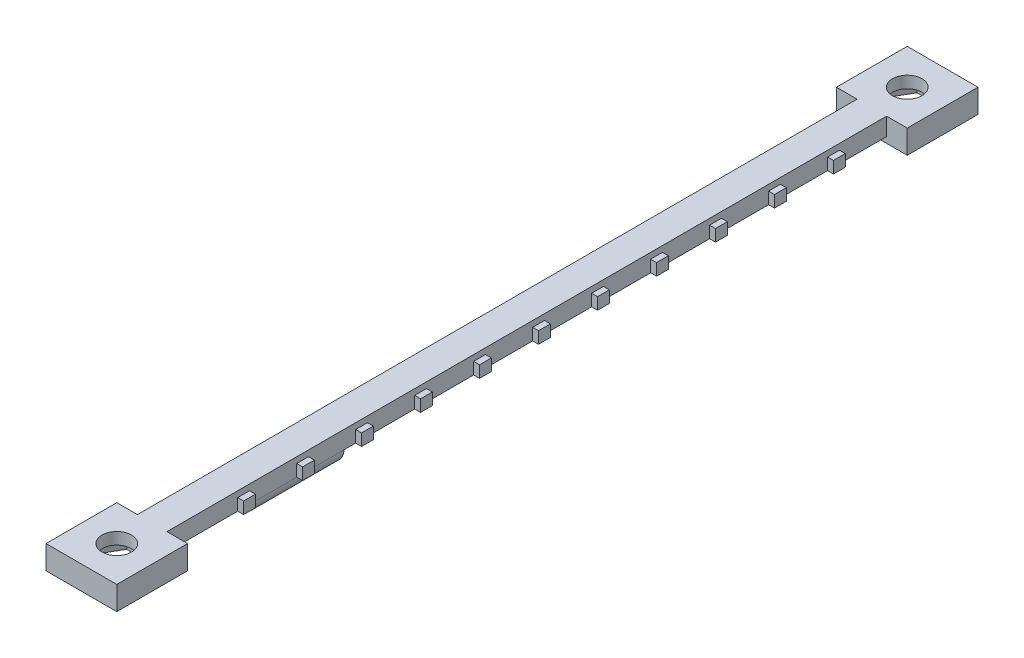
from build123d import *

# Parameters (mm, degrees)
BOSS_EXTRUDE1_DEPTH = 2
BOSS_EXTRUDE2_DEPTH = 1
SKETCH3_W           = 12
SKETCH3_H           = 12
BOSS_EXTRUDE3_DEPTH = 1
CUT_EXTRUDE1_DEPTH  = 2
SKETCH5_R           = 2.5
CUT_EXTRUDE2_DEPTH  = 5
SKETCH6_W           = 3
SKETCH6_H           = 15
BOSS_EXTRUDE4_DEPTH = 5
CUT_EXTRUDE3_DEPTH  = 30
SKETCH9_W           = 3
SKETCH9_H           = 7
CUT_EXTRUDE5_DEPTH  = 20
SKETCH10_W          = 5
SKETCH10_H          = 15
BOSS_EXTRUDE5_DEPTH = 3
CUT_EXTRUDE7_DEPTH  = 20


with BuildPart() as part:
    # Sketch1 → Boss-Extrude1 (new body)
    with BuildSketch(Plane(origin=(0, 0, 0), x_dir=(1, 0, 0), z_dir=(0, 1, 0))):
        Polygon((7.22672382, 6.096), (7.22672382, 18.096), (6.22672382, 18.096), (6.22672382, 20.096), (7.22672382, 20.096), (7.22672382, 28.096), (6.22672382, 28.096), (6.22672382, 30.096), (7.22672382, 30.096), (7.22672382, 38.096), (6.22672382, 38.096), (6.22672382, 40.096), (7.22672382, 40.096), (7.22672382, 48.096), (6.22672382, 48.096), (6.22672382, 50.096), (7.22672382, 50.096), (7.22672382, 58.096), (6.22672382, 58.096), (6.22672382, 60.096), (7.22672382, 60.096), (7.22672382, 68.096), (6.22672382, 68.096), (6.22672382, 70.096), (7.22672382, 70.096), (7.22672382, 78.096), (6.22672382, 78.096), (6.22672382, 80.096), (7.22672382, 80.096), (7.22672382, 88.096), (6.22672382, 88.096), (6.22672382, 90.096), (7.22672382, 90.096), (7.22672382, 98.096), (6.22672382, 98.096), (6.22672382, 100.096), (7.22672382, 100.096), (7.22672382, 108.096), (6.22672382, 108.096), (6.22672382, 110.096), (7.22672382, 110.096), (7.22672382, 118.096), (6.22672382, 118.096), (6.22672382, 120.096), (7.22672382, 120.096), (7.22672382, 128.096), (3.72672382, 128.096), (3.72672382, 140.096), (15.72672382, 140.096), (15.72672382, 128.096), (12.22672382, 128.096), (12.22672382, 120.096), (13.22672382, 120.096), (13.22672382, 118.096), (12.22672382, 118.096), (12.22672382, 110.096), (13.226723821, 110.096), (13.226723821, 108.096), (12.22672382, 108.096), (12.22672382, 100.096), (13.226723821, 100.096), (13.226723821, 98.096), (12.22672382, 98.096), (12.22672382, 90.096), (13.226723821, 90.096), (13.226723821, 88.096), (12.22672382, 88.096), (12.22672382, 80.096), (13.226723821, 80.096), (13.226723821, 78.096), (12.22672382, 78.096), (12.22672382, 70.096), (13.226723821, 70.096), (13.226723821, 68.096), (12.22672382, 68.096), (12.22672382, 60.096), (13.226723821, 60.096), (13.226723821, 58.096), (12.22672382, 58.096), (12.22672382, 50.096), (13.226723821, 50.096), (13.226723821, 48.096), (12.22672382, 48.096), (12.22672382, 40.096), (13.226723821, 40.096), (13.226723821, 38.096), (12.22672382, 38.096), (12.22672382, 30.096), (13.226723821, 30.096), (13.226723821, 28.096), (12.22672382, 28.096), (12.22672382, 20.096), (13.226723821, 20.096), (13.226723821, 18.096), (12.22672382, 18.096), (12.22672382, 6.096), (15.72672382, 6.096), (15.72672382, -5.904), (3.72672382, -5.904), (3.72672382, 6.096), align=None)
    extrude(amount=BOSS_EXTRUDE1_DEPTH)

    # Sketch2 → Boss-Extrude2 (add)
    with BuildSketch(Plane(origin=(0, 2, 0), x_dir=(1, 0, 0), z_dir=(0, 1, 0))):
        Polygon((3.72672382, 140.096), (15.72672382, 140.096), (15.72672382, 128.096), (12.22672382, 128.096), (12.22672382, 6.096), (15.72672382, 6.096), (15.72672382, -5.904), (3.72672382, -5.904), (3.72672382, 6.096), (7.22672382, 6.096), (7.22672382, 128.096), (3.72672382, 128.096), align=None)
    extrude(amount=BOSS_EXTRUDE2_DEPTH)

    # Sketch3 → Boss-Extrude3 (add)
    with BuildSketch(Plane(origin=(0, 0, 0), x_dir=(-1, 0, 0), z_dir=(0, -1, 0))):
        with Locations((-9.72672382, 134.096)):
            Rectangle(SKETCH3_W, SKETCH3_H)
        with Locations((-9.72672382, 0.096)):
            Rectangle(SKETCH3_W, SKETCH3_H)
    extrude(amount=BOSS_EXTRUDE3_DEPTH)

    # Sketch4 → Cut-Extrude1 (cut)
    with BuildSketch(Plane(origin=(0, -1, 0), x_dir=(-1, 0, 0), z_dir=(0, -1, 0))):
        Polygon((-7.365059478, 138.096), (-11.983861632, 138.096), (-14.293262708, 134.096), (-11.983861632, 130.096), (-7.365059478, 130.096), (-5.055658401, 134.096), align=None)
        Polygon((-7.417322744, 4.096), (-12.036124897, 4.096), (-14.345525974, 0.096), (-12.036124897, -3.904), (-7.417322744, -3.904), (-5.107921667, 0.096), align=None)
    extrude(amount=-CUT_EXTRUDE1_DEPTH, mode=Mode.SUBTRACT)

    # Sketch5 → Cut-Extrude2 (cut)
    with BuildSketch(Plane(origin=(0, 1, 0), x_dir=(-1, 0, 0), z_dir=(0, -1, 0))):
        with Locations(Location((-9.72672382, 0.096, 0), (0, 0, 90))):
            Circle(SKETCH5_R)
        with Locations(Location((-9.72672382, 134.096, 0), (0, 0, 90))):
            Circle(SKETCH5_R)
    extrude(amount=-CUT_EXTRUDE2_DEPTH, mode=Mode.SUBTRACT)

    # Sketch6 → Boss-Extrude4 (add)
    with BuildSketch(Plane(origin=(0, 0, 0), x_dir=(-1, 0, 0), z_dir=(0, -1, 0))):
        with Locations((-9.72672382, 28.596)):
            Rectangle(SKETCH6_W, SKETCH6_H)
    extrude(amount=BOSS_EXTRUDE4_DEPTH)

    # Sketch7 → Cut-Extrude3 (cut)
    with BuildSketch(Plane(origin=(0, 0, -36.096), x_dir=(-1, 0, 0), z_dir=(0, 0, -1))):
        with BuildLine():
            Line((-9.72672381, -5), (-8.22672382, -5))
            Line((-8.22672382, -5), (-8.22672382, -1))
            add(Edge.make_bspline(
                [(-9.72672382, -5), (-8.22672382, -5), (-8.22672382, -1)],
                knots=[6.283185307, 6.283185307, 6.283185307, 7.853981634, 7.853981634, 7.853981634], degree=2, weights=[1, 0.707106781, 1]))
        make_face()
        with BuildLine():
            Line((-11.22672382, -5), (-9.72672381, -5))
            add(Edge.make_bspline(
                [(-11.22672382, -1), (-11.22672382, -5), (-9.72672382, -5)],
                knots=[4.71238898, 4.71238898, 4.71238898, 6.283185307, 6.283185307, 6.283185307], degree=2, weights=[1, 0.707106781, 1]))
            Line((-11.22672382, -1), (-11.22672382, -5))
        make_face()
    extrude(amount=-CUT_EXTRUDE3_DEPTH, mode=Mode.SUBTRACT)

    # Sketch9 → Cut-Extrude5 (cut)
    with BuildSketch(Plane.XY.offset(-21.096)):
        with Locations((9.72672382, -3.5)):
            Rectangle(SKETCH9_W, SKETCH9_H)
    extrude(amount=-CUT_EXTRUDE5_DEPTH, mode=Mode.SUBTRACT)

    # Sketch10 → Boss-Extrude5 (add)
    with BuildSketch(Plane(origin=(0, 0, 0), x_dir=(-1, 0, 0), z_dir=(0, -1, 0))):
        with Locations((-9.72672382, 28.596)):
            Rectangle(SKETCH10_W, SKETCH10_H)
    extrude(amount=BOSS_EXTRUDE5_DEPTH)

    # Sketch11 → Cut-Extrude7 (cut)
    with BuildSketch(Plane(origin=(0, 0, -36.096), x_dir=(-1, 0, 0), z_dir=(0, 0, -1))):
        with BuildLine():
            Line((-7.22672382, -3), (-7.22672382, 0))
            ThreePointArc((-7.22672382, 0), (-9.72672382, -2.5), (-12.22672382, 0))
            Line((-12.22672382, 0), (-12.22672382, -3))
            Line((-12.22672382, -3), (-7.22672382, -3))
        make_face()
    extrude(amount=-CUT_EXTRUDE7_DEPTH, mode=Mode.SUBTRACT)


solid = part.part
